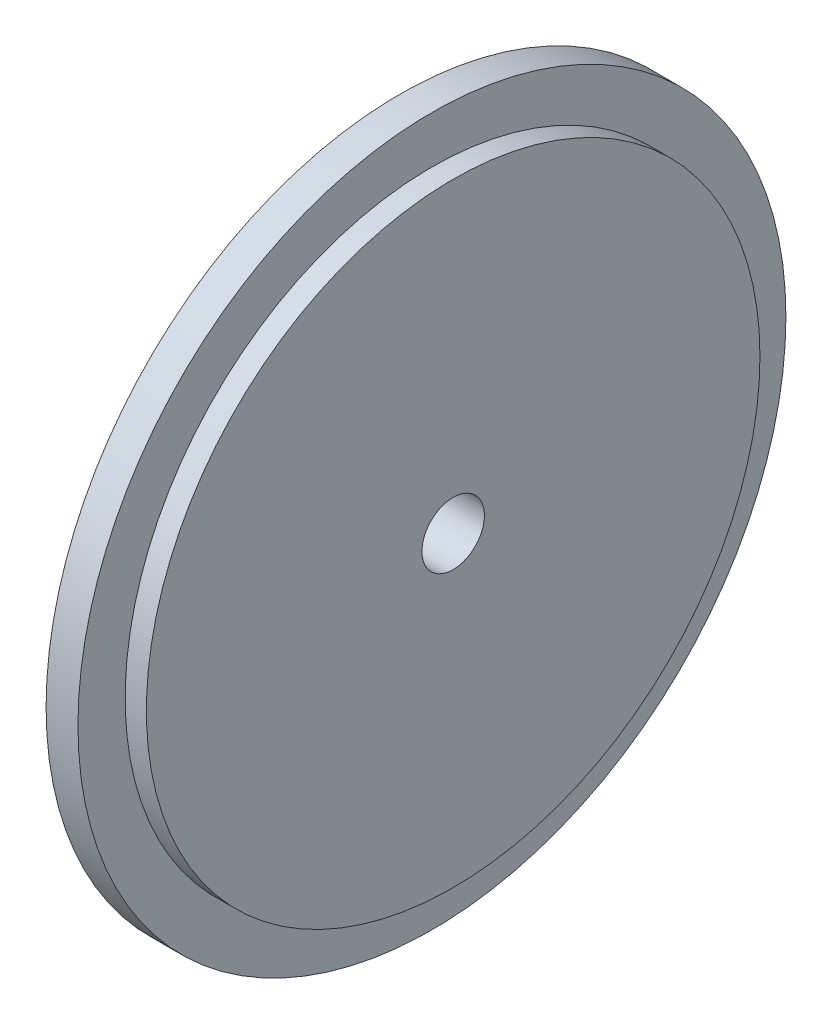
from build123d import *

# Parameters (mm, degrees)
SKETCH1_R           = 30
SKETCH1_R_2         = 2.65
BOSS_EXTRUDE1_DEPTH = 4.5
SKETCH2_R           = 50
SKETCH2_R_2         = 26
CUT_EXTRUDE1_DEPTH  = 1.8


with BuildPart() as part:
    # Sketch1 → Boss-Extrude1 (new body)
    with BuildSketch(Plane(origin=(0, 0, 0), x_dir=(0, 0, -1), z_dir=(1, 0, 0))):
        Circle(SKETCH1_R)
        Circle(SKETCH1_R_2, mode=Mode.SUBTRACT)
    extrude(amount=BOSS_EXTRUDE1_DEPTH)

    # Sketch2 → Cut-Extrude1 (cut)
    with BuildSketch(Plane(origin=(4.5, 0, 0), x_dir=(0, 0, -1), z_dir=(1, 0, 0))):
        Circle(SKETCH2_R)
        Circle(SKETCH2_R_2, mode=Mode.SUBTRACT)
    extrude(amount=-CUT_EXTRUDE1_DEPTH, mode=Mode.SUBTRACT)


solid = part.part
